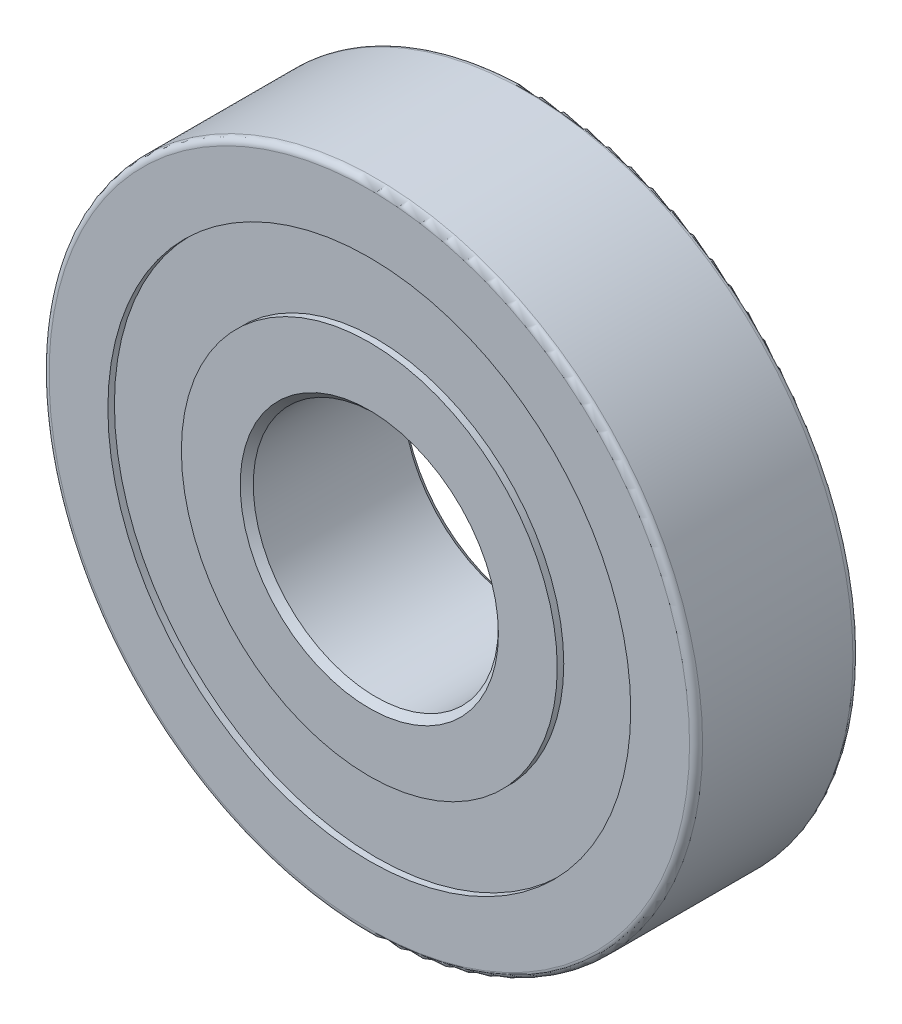
from build123d import *

# Parameters (mm, degrees)
SKETCH1_R             = 6.35
SKETCH1_R_2           = 5.08
BOSS_EXTRUDE1_DEPTH   = 1.5875
SKETCH1_R_3           = 3.652012
SKETCH1_R_4           = 2.382012
BOSS_EXTRUDE1_2_DEPTH = 1.5875
SKETCH2_R             = 5.08
SKETCH2_R_2           = 3.652012
BOSS_EXTRUDE2_DEPTH   = 1.4605
FILLET1_R             = 0.127
CHAMFER1_SIZE         = 0.127


with BuildPart() as part:
    # Sketch1 → Boss-Extrude1 (new, symmetric)
    with BuildSketch(Plane.XY):
        Circle(SKETCH1_R)
        Circle(SKETCH1_R_2, mode=Mode.SUBTRACT)
    extrude(amount=BOSS_EXTRUDE1_DEPTH, both=True)



with BuildPart() as body_2:
    # Sketch1 → Boss-Extrude1 2 (new, symmetric)
    with BuildSketch(Plane.XY):
        Circle(SKETCH1_R_3)
        Circle(SKETCH1_R_4, mode=Mode.SUBTRACT)
    extrude(amount=BOSS_EXTRUDE1_2_DEPTH, both=True)


with BuildPart() as part_1:
    add(part.part)

    add(body_2.part)  # Boss-Extrude2 merges body 2
    # Sketch2 → Boss-Extrude2 (add, symmetric)
    with BuildSketch(Plane.XY):
        Circle(SKETCH2_R)
        Circle(SKETCH2_R_2, mode=Mode.SUBTRACT)
    extrude(amount=BOSS_EXTRUDE2_DEPTH, both=True)

    # Fillet1
    fillet1_edges = [part_1.edges().sort_by_distance(p)[0] for p in [
        (-6.35, 0, 1.5875),
        (-6.35, 0, -1.5875),
    ]]
    fillet(fillet1_edges, radius=FILLET1_R)

    # Chamfer1
    chamfer1_edges = [part_1.edges().sort_by_distance(p)[0] for p in [
        (-2.382012, 0, 1.5875),
        (-2.382012, 0, -1.5875),
    ]]
    chamfer(chamfer1_edges, length=CHAMFER1_SIZE)


solid = part_1.part
